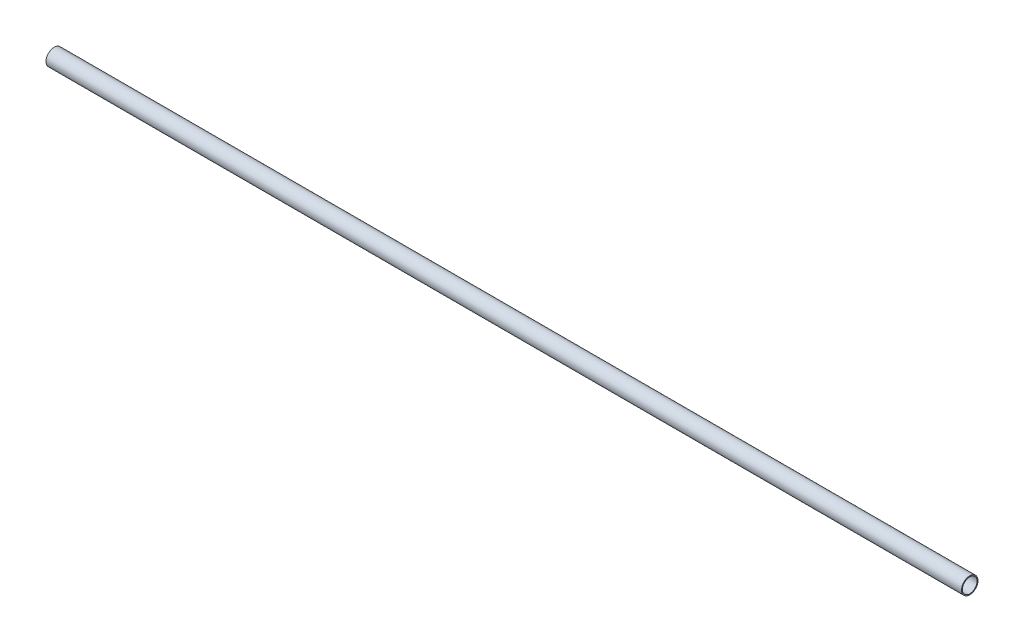
from build123d import *

# Parameters (mm, degrees)
SKETCH1_R           = 9
SKETCH1_R_2         = 8
BOSS_EXTRUDE1_DEPTH = 500


with BuildPart() as part:
    # Sketch1 → Boss-Extrude1 (new, symmetric)
    with BuildSketch(Plane(origin=(0, 0, 0), x_dir=(0, 0, -1), z_dir=(1, 0, 0))):
        Circle(SKETCH1_R)
        Circle(SKETCH1_R_2, mode=Mode.SUBTRACT)
    extrude(amount=BOSS_EXTRUDE1_DEPTH, both=True)


solid = part.part
